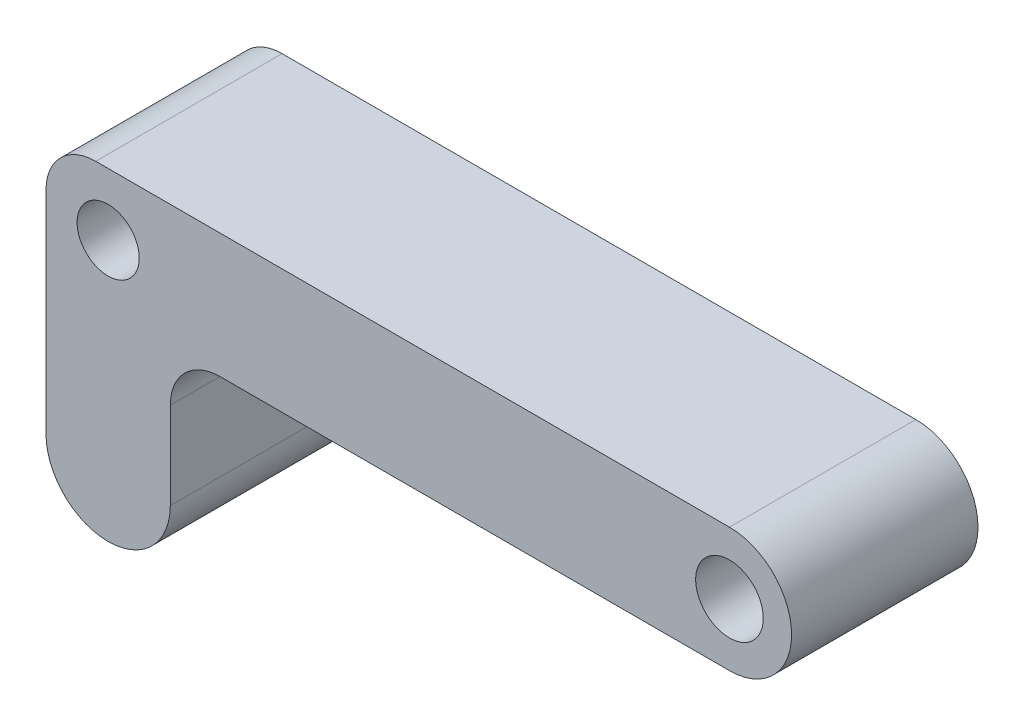
from build123d import *

# Parameters (mm, degrees)
BOSS_EXTRUDE1_DEPTH   = 9.525
FILLET1_R             = 2.54
SKETCH5_R             = 1.5875
CUT_EXTRUDE1_DEPTH    = 39.578536455
F_8_32_TAPPED_HOLE1_D = 3.4544


with BuildPart() as part:
    # Sketch1 → Boss-Extrude1 (new body)
    with BuildSketch(Plane.XY):
        with BuildLine():
            Line((3.175, 6.985), (3.175, 0))
            ThreePointArc((3.175, 0), (0, -3.175), (-3.175, 0))
            Line((-3.175, 0), (-3.175, 13.335))
            Line((-3.175, 13.335), (31.75, 13.335))
            ThreePointArc((31.75, 13.335), (34.925, 10.16), (31.75, 6.985))
            Line((31.75, 6.985), (3.175, 6.985))
        make_face()
    extrude(amount=BOSS_EXTRUDE1_DEPTH)

    # Fillet1
    fillet1_edges = [part.edges().sort_by_distance(p)[0] for p in [
        (3.175, 6.985, 4.7625),
        (-3.175, 13.335, 4.7625),
    ]]
    fillet(fillet1_edges, radius=FILLET1_R)

    # Sketch5 → Cut-Extrude1 (cut, through all)
    with BuildSketch(Plane.XY.offset(9.525)):
        with Locations((0, 10.16)):
            Circle(SKETCH5_R)
    extrude(amount=-CUT_EXTRUDE1_DEPTH, mode=Mode.SUBTRACT)

    # #8-32 Tapped Hole1 (through all)
    with Locations(Plane.XY.offset(9.525)):
        with Locations((31.75, 10.16)):
            Hole(F_8_32_TAPPED_HOLE1_D / 2)


solid = part.part
